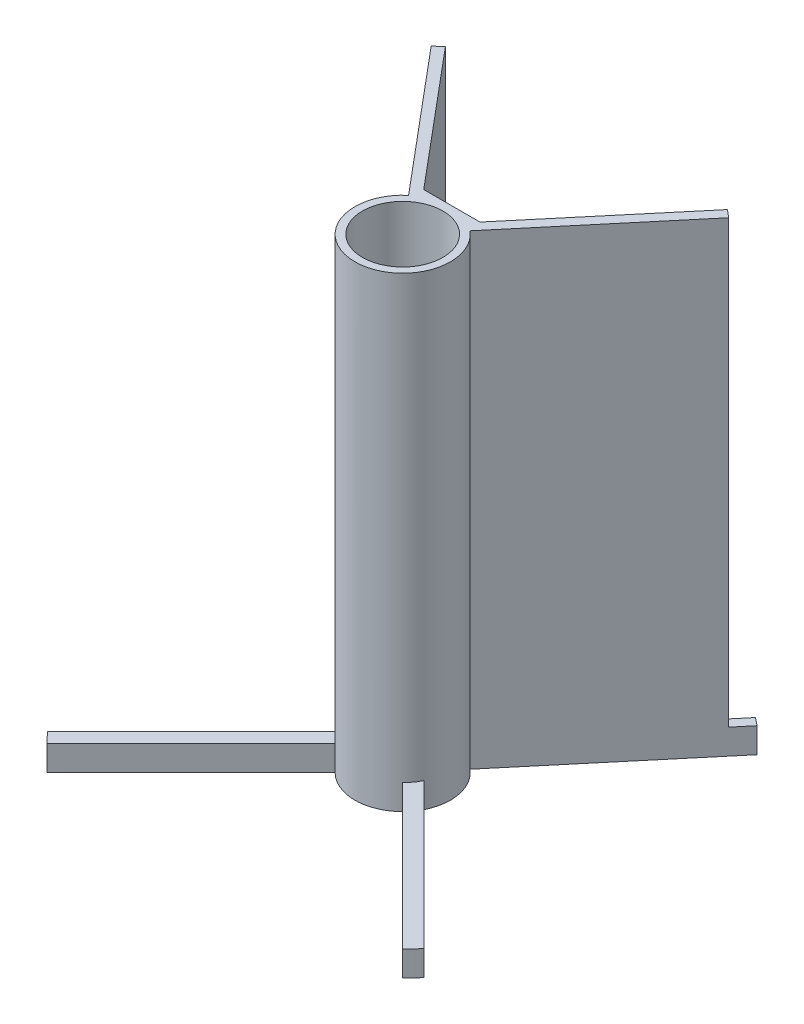
from build123d import *

# Parameters (mm, degrees)
SKETCH1_R           = 9.5
BOSS_EXTRUDE1_DEPTH = 92.7
EXTRUDE_THIN1_DEPTH = 92.7
SKETCH13_W          = 2
SKETCH13_H          = 5
BOSS_EXTRUDE8_DEPTH = 5
EXTRUDE_THIN3_DEPTH = 5
SKETCH15_W          = 12.212964584
SKETCH15_H          = 2.5
BOSS_EXTRUDE9_DEPTH = 92.7
SKETCH16_R          = 8
CUT_EXTRUDE1_DEPTH  = 90
SKETCH17_R          = 55
SKETCH17_R_2        = 50
CUT_EXTRUDE2_DEPTH  = 5


with BuildPart() as part:
    # Sketch1 → Boss-Extrude1 (new body)
    with BuildSketch(Plane(origin=(0, 0, 0), x_dir=(1, 0, 0), z_dir=(0, 1, 0))):
        with Locations(Location((0, 0, 0), (0, 0, 270))):
            Circle(SKETCH1_R)
    extrude(amount=BOSS_EXTRUDE1_DEPTH)

    # Sketch2 → Extrude-Thin1 (add)
    with BuildSketch(Plane(origin=(0, 92.7, 0), x_dir=(1, 0, 0), z_dir=(0, 1, 0))):
        Polygon((0, 0), (-29.568230046, 35.238044383), (-28.036141159, 36.523619603), (1.532088886, 1.285575219), align=None)
    extrude_thin1 = extrude(amount=-EXTRUDE_THIN1_DEPTH)

    # Sketch13 → Boss-Extrude8 (add)
    with BuildSketch(Plane(origin=(-29.568230046, 0, -35.238044383), x_dir=(-0.7660444431189722, 0, 0.6427876096865464), z_dir=(-0.6427876096865464, 0, -0.7660444431189722))):
        with Locations((-1, 2.5)):
            Rectangle(SKETCH13_W, SKETCH13_H)
    boss_extrude8 = extrude(amount=BOSS_EXTRUDE8_DEPTH)

    # Mirror1: Extrude-Thin1, Boss-Extrude8 across plane
    add(extrude_thin1.mirror(Plane(origin=(0, 0, 0), x_dir=(0, 0, 1), z_dir=(1, 0, 0))))
    add(boss_extrude8.mirror(Plane(origin=(0, 0, 0), x_dir=(0, 0, 1), z_dir=(1, 0, 0))))

    # Sketch14 → Extrude-Thin3 (add)
    with BuildSketch(Plane.XZ):
        Polygon((0, 0), (36.062445841, 36.062445841), (38.183766184, 33.941125497), (2.121320344, -2.121320344), align=None)
    extrude_thin3 = extrude(amount=-EXTRUDE_THIN3_DEPTH)

    # Mirror6: Extrude-Thin3 across plane
    add(extrude_thin3.mirror(Plane(origin=(0, 0, 0), x_dir=(0, 0, 1), z_dir=(1, 0, 0))))

    # Sketch15 → Boss-Extrude9 (add)
    with BuildSketch(Plane.XZ):
        with Locations((0, -8.52742221)):
            Rectangle(SKETCH15_W, SKETCH15_H)
    extrude(amount=-BOSS_EXTRUDE9_DEPTH)

    # Sketch16 → Cut-Extrude1 (cut)
    with BuildSketch(Plane(origin=(0, 92.7, 0), x_dir=(1, 0, 0), z_dir=(0, 1, 0))):
        with Locations(Location((0, 0, 0), (0, 0, 270))):
            Circle(SKETCH16_R)
    extrude(amount=-CUT_EXTRUDE1_DEPTH, mode=Mode.SUBTRACT)

    # Sketch17 → Cut-Extrude2 (cut)
    with BuildSketch(Plane.XZ):
        Circle(SKETCH17_R)
        Circle(SKETCH17_R_2, mode=Mode.SUBTRACT)
    extrude(amount=-CUT_EXTRUDE2_DEPTH, mode=Mode.SUBTRACT)


solid = part.part
